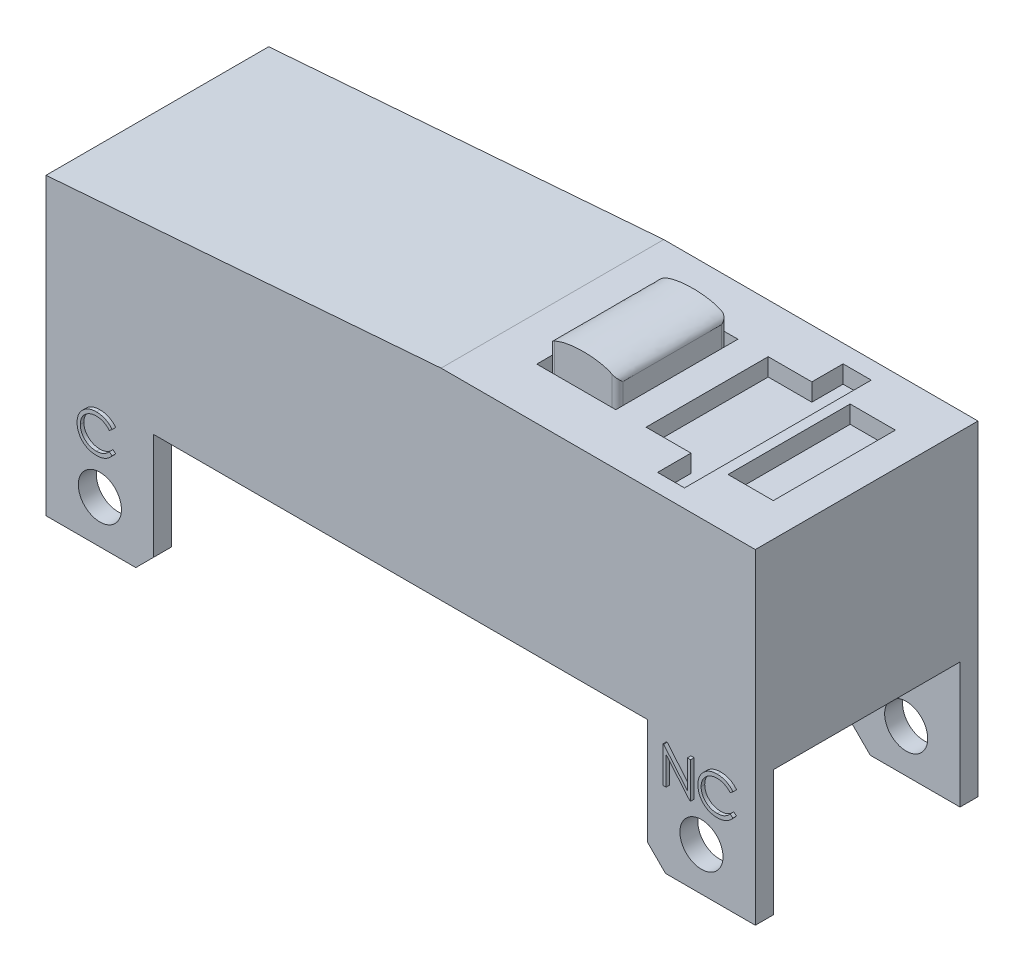
from build123d import *

# Parameters (mm, degrees)
SKETCH3_R               = 0.6
BOSS_EXTRUDE1_DEPTH     = 6.2
SHELL1_T                = -0.5
CUT_EXTRUDE1_DEPTH      = 22.672823682
CUT_EXTRUDE1_DEPTH_BACK = 22.672823682
SKETCH5_W               = 5.2
SKETCH5_H               = 3.5
SKETCH6_W               = 1.26
SKETCH6_H               = 3.4
CUT_EXTRUDE2_DEPTH      = 0.49
SKETCH7_W               = 2.2
SKETCH7_H               = 3.4
CUT_EXTRUDE3_DEPTH      = 0.49
BOSS_EXTRUDE2_DEPTH     = 1.24
CUT_EXTRUDE4_DEPTH      = 15.430314711
CUT_EXTRUDE4_DEPTH_BACK = 15.430314711
BOSS_EXTRUDE3_DEPTH     = 0.1


with BuildPart() as part:
    # Sketch3 → Boss-Extrude1 (new body)
    with BuildSketch(Plane.XY):
        Polygon((11.659703504, 6.419407008), (5.659703504, 6.419407008), (2.909703504, 6.419407008), (-8.090296496, 5.569407008), (-8.090296496, -2.640592992), (-5.590296496, -2.640592992), (-5.090296496, -2.140592992), (-5.090296496, 0.819407008), (8.659703504, 0.819407008), (8.659703504, -2.140592992), (9.159703504, -2.640592992), (11.659703504, -2.640592992), align=None)
        with Locations((-6.590296496, -1.440592992)):
            Circle(SKETCH3_R, mode=Mode.SUBTRACT)
        with Locations((10.159703504, -1.440592992)):
            Circle(SKETCH3_R, mode=Mode.SUBTRACT)
    extrude(amount=BOSS_EXTRUDE1_DEPTH)

    # Shell1
    shell1_openings = [part.faces().sort_by_distance(p)[0] for p in [
        (10.409703504, -2.640592992, 3.1),
        (8.659703504, -0.660592992, 3.1),
        (1.784703504, 0.819407008, 3.1),
        (-5.090296496, -0.660592992, 3.1),
        (-6.840296496, -2.640592992, 3.1),
    ]]
    offset(amount=SHELL1_T, openings=shell1_openings)

    # Sketch5 → Cut-Extrude1 (cut, two sides: drawn at the far end of the back side and taken through both)
    with BuildSketch(Plane(origin=(11.659703504, 0, 0), x_dir=(0, 0, -1), z_dir=(1, 0, 0)).offset(-CUT_EXTRUDE1_DEPTH_BACK)):
        with Locations((-3.1, -0.890592992)):
            Rectangle(SKETCH5_W, SKETCH5_H)
    extrude(amount=CUT_EXTRUDE1_DEPTH + CUT_EXTRUDE1_DEPTH_BACK, mode=Mode.SUBTRACT)

    # Sketch6 → Cut-Extrude2 (cut)
    with BuildSketch(Plane(origin=(0, 6.419407008, 0), x_dir=(1, 0, 0), z_dir=(0, 1, 0))):
        with Locations((10.099703504, -3.07)):
            Rectangle(SKETCH6_W, SKETCH6_H)
    extrude(amount=-CUT_EXTRUDE2_DEPTH, mode=Mode.SUBTRACT)

    # Sketch7 → Cut-Extrude3 (cut)
    with BuildSketch(Plane(origin=(0, 6.419407008, 0), x_dir=(1, 0, 0), z_dir=(0, 1, 0))):
        Polygon((9.18784127, -0.5), (9.18784127, -5.7), (8.43784127, -5.7), (8.43784127, -4.77), (7.18784127, -4.77), (7.18784127, -1.37), (8.403045117, -1.37), (8.403045117, -0.5), align=None)
        with Locations((5.244810149, -3.07)):
            Rectangle(SKETCH7_W, SKETCH7_H)
    extrude(amount=-CUT_EXTRUDE3_DEPTH, mode=Mode.SUBTRACT)

    # Sketch8 → Boss-Extrude2 (add)
    with BuildSketch(Plane(origin=(0, 5.929407008, 0), x_dir=(1, 0, 0), z_dir=(0, 1, 0))):
        with BuildLine():
            Line((4.444810149, -1.52), (6.044810149, -1.52))
            ThreePointArc((6.044810149, -1.52), (6.150876166, -1.563933983), (6.194810149, -1.67))
            Line((6.194810149, -1.67), (6.194810149, -4.42))
            ThreePointArc((6.194810149, -4.42), (6.150876166, -4.526066017), (6.044810149, -4.57))
            Line((6.044810149, -4.57), (4.444810149, -4.57))
            ThreePointArc((4.444810149, -4.57), (4.338744132, -4.526066017), (4.294810149, -4.42))
            Line((4.294810149, -4.42), (4.294810149, -1.67))
            ThreePointArc((4.294810149, -1.67), (4.338744132, -1.563933983), (4.444810149, -1.52))
        make_face()
    extrude(amount=BOSS_EXTRUDE2_DEPTH)

    # Sketch9 → Cut-Extrude4 (cut, two sides: drawn at the far end of the back side and taken through both)
    with BuildSketch(Plane.XY.offset(4.57).offset(-CUT_EXTRUDE4_DEPTH_BACK)):
        with BuildLine():
            Line((4.294810149, 7.169407008), (4.294810149, 6.847617942))
            add(Edge.make_bspline(
                [(4.444810149, 7.021163032), (4.294810149, 6.941828134), (4.294810149, 6.847617942)],
                knots=[5.703153856, 5.703153856, 5.703153856, 6.283185307, 6.283185307, 6.283185307], degree=2, weights=[0.863566286, 0.891846399, 1]))
            Line((4.444810149, 7.021163032), (4.444810149, 7.169407008))
            Line((4.444810149, 7.169407008), (4.294810149, 7.169407008))
        make_face()
        with BuildLine():
            Line((4.444810149, 7.169407008), (4.444810149, 7.021163032))
            add(Edge.make_bspline(
                [(5.244810149, 7.169407008), (4.725097851, 7.169407008), (4.444810149, 7.021163032)],
                knots=[4.71238898, 4.71238898, 4.71238898, 5.703153856, 5.703153856, 5.703153856], degree=2, weights=[1, 0.815260382, 0.863566286]))
            Line((5.244810172, 7.169407008), (4.444810149, 7.169407008))
        make_face()
        with BuildLine():
            Line((6.044810149, 7.169407008), (5.244810172, 7.169407008))
            add(Edge.make_bspline(
                [(6.044810149, 7.021163032), (5.764522447, 7.169407008), (5.244810149, 7.169407008)],
                knots=[3.721624105, 3.721624105, 3.721624105, 4.71238898, 4.71238898, 4.71238898], degree=2, weights=[0.863566286, 0.815260382, 1]))
            Line((6.044810149, 7.021163032), (6.044810149, 7.169407008))
        make_face()
        with BuildLine():
            Line((6.194810149, 7.169407008), (6.044810149, 7.169407008))
            Line((6.044810149, 7.169407008), (6.044810149, 7.021163032))
            add(Edge.make_bspline(
                [(6.194810149, 6.847617942), (6.194810149, 6.941828134), (6.044810149, 7.021163032)],
                knots=[3.141592654, 3.141592654, 3.141592654, 3.721624105, 3.721624105, 3.721624105], degree=2, weights=[1, 0.891846399, 0.863566286]))
            Line((6.194810149, 6.847617942), (6.194810149, 7.169407008))
        make_face()
    extrude(amount=CUT_EXTRUDE4_DEPTH + CUT_EXTRUDE4_DEPTH_BACK, mode=Mode.SUBTRACT)

    # Sketch11 → Boss-Extrude3 (add)
    with BuildSketch(Plane.XY.offset(6.2)):
        Polygon((9.18687242, -0.45139452), (9.18687242, 0.54860548), (9.205702548, 0.54860548), (9.8663596, -0.238453815), (9.8663596, 0.54860548), (9.956103189, 0.54860548), (9.956103189, -0.45139452), (9.935670497, -0.45139452), (9.27661601, 0.333861891), (9.27661601, -0.45139452), align=None)
        with BuildLine():
            Line((11.135590369, 0.365111891), (11.057064728, 0.305015737))
            add(Edge.make_bspline(
                [(11.057064728, 0.305015737), (11.051463045, 0.311691728), (11.040335203, 0.324953704), (11.022432574, 0.343576431), (11.003774962, 0.361023649), (10.984369499, 0.377378471), (10.963866893, 0.392068976), (10.942763808, 0.40586072), (10.920707223, 0.41822293), (10.890206728, 0.433212355), (10.850307343, 0.448854114), (10.800080246, 0.461969323), (10.747648503, 0.47031823), (10.711877761, 0.47122247), (10.693683317, 0.471682403)],
                knots=[0, 0, 0, 0, 0.757959112, 1.505699292, 2.245454638, 2.979532153, 3.711538275, 4.438200793, 5.171680507, 5.909471876, 7.393775596, 8.890124382, 10.418191784, 12, 12, 12, 12], degree=3))
            add(Edge.make_bspline(
                [(10.693683317, 0.471682403), (10.683659518, 0.471566986), (10.663704948, 0.471337221), (10.634091099, 0.468306042), (10.605030227, 0.464045697), (10.576541237, 0.457724176), (10.548660391, 0.449731999), (10.521205419, 0.440181881), (10.494573819, 0.428366212), (10.46839718, 0.415306709), (10.443317405, 0.400556011), (10.419587392, 0.384466482), (10.397293687, 0.367218168), (10.376418655, 0.348746424), (10.356940955, 0.329134435), (10.339001723, 0.308173195), (10.322663035, 0.285929716), (10.307601028, 0.262697314), (10.294111675, 0.238543659), (10.282817424, 0.213379354), (10.27281596, 0.187635324), (10.264901891, 0.161020707), (10.258637743, 0.133722774), (10.254315554, 0.105668263), (10.251318848, 0.076915783), (10.251090226, 0.057427408), (10.250974984, 0.047603878)],
                knots=[0, 0, 0, 0, 1.054917814, 2.100044995, 3.131103042, 4.146048494, 5.169673617, 6.183595914, 7.203665975, 8.234915748, 9.262203917, 10.264457458, 11.251630812, 12.227803204, 13.197192746, 14.159520551, 15.12972552, 16.100847026, 17.073214652, 18.039054194, 19.002613845, 19.979014051, 20.95965708, 21.949030935, 22.966165397, 24, 24, 24, 24], degree=3))
            add(Edge.make_bspline(
                [(10.250974984, 0.047603878), (10.251335504, 0.032823501), (10.252043337, 0.003804191), (10.258342861, -0.038701698), (10.267915744, -0.079421891), (10.282263051, -0.118101845), (10.299954209, -0.155218519), (10.322308669, -0.190143906), (10.348199108, -0.223405781), (10.3779918, -0.254218052), (10.410679176, -0.282364831), (10.445750008, -0.307150711), (10.483116947, -0.327812106), (10.522367413, -0.345005234), (10.563803445, -0.358221442), (10.607350532, -0.367525477), (10.652913959, -0.373594672), (10.684048073, -0.374175725), (10.699893253, -0.374471443)],
                knots=[0, 0, 0, 0, 1.029171465, 2.020641659, 2.987623507, 3.938342917, 4.889210282, 5.84687017, 6.821220943, 7.821438502, 8.827599549, 9.822697543, 10.807740252, 11.797342354, 12.80366471, 13.83203677, 14.896651826, 16, 16, 16, 16], degree=3))
            add(Edge.make_bspline(
                [(10.699893253, -0.374471443), (10.717351165, -0.373988934), (10.75171251, -0.373039242), (10.802103375, -0.364993742), (10.850342165, -0.351948623), (10.896431475, -0.333692074), (10.940241374, -0.309959134), (10.98184042, -0.281188312), (11.021263726, -0.247105931), (11.044969806, -0.22108218), (11.057064728, -0.207804776)],
                knots=[0, 0, 0, 0, 1.028121516, 2.023589091, 2.998037872, 3.967518031, 4.937445131, 5.927275754, 6.942489185, 8, 8, 8, 8], degree=3))
            Line((11.057064728, -0.207804776), (11.135590369, -0.267299968))
            add(Edge.make_bspline(
                [(11.135590369, -0.267299968), (11.129270909, -0.275453812), (11.116662259, -0.291722442), (11.096245682, -0.314657216), (11.074737883, -0.336229798), (11.051979109, -0.356266261), (11.028231168, -0.375167537), (11.003067651, -0.392396632), (10.976819356, -0.408194027), (10.949575219, -0.422658863), (10.921364187, -0.435492362), (10.892220062, -0.446479153), (10.862268469, -0.455943407), (10.831508038, -0.463729674), (10.799874965, -0.469807127), (10.767483401, -0.473869891), (10.734263437, -0.476653295), (10.711851602, -0.476906986), (10.700494215, -0.477035545)],
                knots=[0, 0, 0, 0, 0.986787822, 1.968848986, 2.935600012, 3.899624008, 4.868462664, 5.837806735, 6.815139263, 7.798259679, 8.787526145, 9.778297419, 10.776456485, 11.791383307, 12.812564526, 13.85620153, 14.913611965, 16, 16, 16, 16], degree=3))
            add(Edge.make_bspline(
                [(10.700494215, -0.477035545), (10.689738881, -0.47696069), (10.668471541, -0.476812674), (10.637071898, -0.474414912), (10.606503446, -0.471143558), (10.576853553, -0.466217806), (10.547960418, -0.460405138), (10.520085965, -0.45261335), (10.492955905, -0.443885017), (10.466679236, -0.433626449), (10.441233608, -0.422050397), (10.41670109, -0.408967095), (10.393092966, -0.394486562), (10.370177132, -0.378927987), (10.348292108, -0.361791616), (10.327248244, -0.343315434), (10.306927536, -0.323561717), (10.29435534, -0.309317473), (10.288034279, -0.302155738)],
                knots=[0, 0, 0, 0, 1.114604814, 2.203992996, 3.262667896, 4.300477797, 5.318619304, 6.316056647, 7.298880507, 8.271930387, 9.238335007, 10.195173496, 11.151986948, 12.108099108, 13.064862484, 14.031167946, 15.010108607, 16, 16, 16, 16], degree=3))
            add(Edge.make_bspline(
                [(10.288034279, -0.302155738), (10.277909809, -0.289715398), (10.257783102, -0.264984909), (10.232032906, -0.2249032), (10.209990748, -0.183055141), (10.192169056, -0.139220875), (10.178236847, -0.093498765), (10.168585077, -0.04586576), (10.16231319, 0.003633652), (10.161595964, 0.037301305), (10.161231394, 0.054414775)],
                knots=[0, 0, 0, 0, 0.994628077, 1.977248131, 2.950237994, 3.925870899, 4.908910175, 5.911660606, 6.938484602, 8, 8, 8, 8], degree=3))
            add(Edge.make_bspline(
                [(10.161231394, 0.054414775), (10.161675735, 0.072402048), (10.162549949, 0.107790883), (10.169977319, 0.159726298), (10.181925546, 0.209483841), (10.198896086, 0.256970625), (10.220411901, 0.30243642), (10.246990933, 0.345533907), (10.278324402, 0.386538707), (10.314166564, 0.424828635), (10.353471517, 0.459839879), (10.395562607, 0.490641652), (10.440357449, 0.516275228), (10.48736255, 0.537702703), (10.536929887, 0.554172549), (10.588953707, 0.565702031), (10.643336254, 0.57287835), (10.680439804, 0.573785552), (10.699292292, 0.574246506)],
                knots=[0, 0, 0, 0, 1.032925535, 2.032216505, 3.007276963, 3.968222605, 4.92396291, 5.891752235, 6.871517503, 7.883894988, 8.900124299, 9.891468569, 10.874487609, 11.85992873, 12.854644235, 13.869047385, 14.917252991, 16, 16, 16, 16], degree=3))
            add(Edge.make_bspline(
                [(10.699292292, 0.574246506), (10.710782141, 0.574108752), (10.73352514, 0.573836083), (10.767168755, 0.571177185), (10.799923706, 0.566744726), (10.831812558, 0.560711563), (10.862990448, 0.553223757), (10.893219088, 0.543469386), (10.922675856, 0.532316091), (10.951174973, 0.519470815), (10.978579701, 0.505051746), (11.004881507, 0.489218711), (11.029871466, 0.471991338), (11.053725423, 0.453516145), (11.07604434, 0.433402271), (11.097461906, 0.412202958), (11.117250785, 0.38930758), (11.129465984, 0.373191884), (11.135590369, 0.365111891)],
                knots=[0, 0, 0, 0, 1.096760587, 2.17092713, 3.219439832, 4.250915756, 5.268269357, 6.278326846, 7.281116186, 8.274029601, 9.260640565, 10.235837813, 11.203064059, 12.156899882, 13.114053108, 14.069676657, 15.032185724, 16, 16, 16, 16], degree=3))
        make_face()
        with BuildLine():
            Line((-6.15051233, 0.457442588), (-6.229037971, 0.397346434))
            add(Edge.make_bspline(
                [(-6.229037971, 0.397346434), (-6.234639654, 0.404022425), (-6.245767496, 0.417284401), (-6.263670125, 0.435907128), (-6.282327737, 0.453354346), (-6.3017332, 0.469709169), (-6.322235806, 0.484399673), (-6.343338891, 0.498191417), (-6.365395476, 0.510553628), (-6.395895971, 0.525543052), (-6.435795356, 0.541184811), (-6.486022453, 0.55430002), (-6.538454196, 0.562648927), (-6.574224938, 0.563553167), (-6.592419382, 0.564013101)],
                knots=[0, 0, 0, 0, 0.757959112, 1.505699292, 2.245454638, 2.979532153, 3.711538275, 4.438200793, 5.171680507, 5.909471876, 7.393775596, 8.890124382, 10.418191784, 12, 12, 12, 12], degree=3))
            add(Edge.make_bspline(
                [(-6.592419382, 0.564013101), (-6.602443181, 0.563897683), (-6.622397751, 0.563667918), (-6.6520116, 0.56063674), (-6.681072472, 0.556376394), (-6.709561462, 0.550054873), (-6.737442308, 0.542062696), (-6.76489728, 0.532512578), (-6.79152888, 0.520696909), (-6.817705519, 0.507637406), (-6.842785294, 0.492886708), (-6.866515307, 0.476797179), (-6.888809012, 0.459548866), (-6.909684044, 0.441077121), (-6.929161744, 0.421465132), (-6.947100976, 0.400503892), (-6.963439664, 0.378260414), (-6.978501671, 0.355028011), (-6.991991024, 0.330874357), (-7.003285275, 0.305710051), (-7.013286739, 0.279966021), (-7.021200808, 0.253351404), (-7.027464956, 0.226053471), (-7.031787145, 0.19799896), (-7.034783851, 0.16924648), (-7.035012473, 0.149758105), (-7.035127715, 0.139934575)],
                knots=[0, 0, 0, 0, 1.054917814, 2.100044995, 3.131103042, 4.146048494, 5.169673617, 6.183595914, 7.203665975, 8.234915748, 9.262203917, 10.264457458, 11.251630812, 12.227803204, 13.197192746, 14.159520551, 15.12972552, 16.100847026, 17.073214652, 18.039054194, 19.002613845, 19.979014051, 20.95965708, 21.949030935, 22.966165397, 24, 24, 24, 24], degree=3))
            add(Edge.make_bspline(
                [(-7.035127715, 0.139934575), (-7.034767195, 0.125154198), (-7.034059362, 0.096134888), (-7.027759838, 0.053628999), (-7.018186955, 0.012908807), (-7.003839648, -0.025771148), (-6.98614849, -0.062887822), (-6.96379403, -0.097813209), (-6.937903591, -0.131075084), (-6.908110899, -0.161887355), (-6.875423523, -0.190034134), (-6.840352691, -0.214820014), (-6.802985752, -0.235481409), (-6.763735286, -0.252674537), (-6.722299254, -0.265890745), (-6.678752167, -0.27519478), (-6.63318874, -0.281263974), (-6.602054626, -0.281845028), (-6.586209446, -0.282140746)],
                knots=[0, 0, 0, 0, 1.029171465, 2.020641659, 2.987623507, 3.938342917, 4.889210282, 5.84687017, 6.821220943, 7.821438502, 8.827599549, 9.822697543, 10.807740252, 11.797342354, 12.80366471, 13.83203677, 14.896651826, 16, 16, 16, 16], degree=3))
            add(Edge.make_bspline(
                [(-6.586209446, -0.282140746), (-6.568751534, -0.281658237), (-6.534390189, -0.280708545), (-6.483999324, -0.272663045), (-6.435760534, -0.259617926), (-6.389671224, -0.241361376), (-6.345861325, -0.217628437), (-6.304262279, -0.188857615), (-6.264838973, -0.154775234), (-6.241132893, -0.128751483), (-6.229037971, -0.115474079)],
                knots=[0, 0, 0, 0, 1.028121516, 2.023589091, 2.998037872, 3.967518031, 4.937445131, 5.927275754, 6.942489185, 8, 8, 8, 8], degree=3))
            Line((-6.229037971, -0.115474079), (-6.15051233, -0.174969271))
            add(Edge.make_bspline(
                [(-6.15051233, -0.174969271), (-6.15683179, -0.183123115), (-6.16944044, -0.199391745), (-6.189857017, -0.222326519), (-6.211364816, -0.243899101), (-6.23412359, -0.263935564), (-6.257871531, -0.28283684), (-6.283035048, -0.300065934), (-6.309283343, -0.31586333), (-6.33652748, -0.330328166), (-6.364738512, -0.343161665), (-6.393882637, -0.354148455), (-6.42383423, -0.36361271), (-6.454594661, -0.371398977), (-6.486227734, -0.37747643), (-6.518619298, -0.381539194), (-6.551839262, -0.384322598), (-6.574251097, -0.384576288), (-6.585608484, -0.384704848)],
                knots=[0, 0, 0, 0, 0.986787822, 1.968848986, 2.935600012, 3.899624008, 4.868462664, 5.837806735, 6.815139263, 7.798259679, 8.787526145, 9.778297419, 10.776456485, 11.791383307, 12.812564526, 13.85620153, 14.913611965, 16, 16, 16, 16], degree=3))
            add(Edge.make_bspline(
                [(-6.585608484, -0.384704848), (-6.596363818, -0.384629993), (-6.617631158, -0.384481977), (-6.649030801, -0.382084214), (-6.679599253, -0.378812861), (-6.709249146, -0.373887109), (-6.738142281, -0.368074441), (-6.766016734, -0.360282653), (-6.793146794, -0.35155432), (-6.819423463, -0.341295752), (-6.844869091, -0.3297197), (-6.869401609, -0.316636397), (-6.893009733, -0.302155865), (-6.915925567, -0.28659729), (-6.937810591, -0.269460918), (-6.958854455, -0.250984737), (-6.979175163, -0.23123102), (-6.991747359, -0.216986776), (-6.99806842, -0.20982504)],
                knots=[0, 0, 0, 0, 1.114604814, 2.203992996, 3.262667896, 4.300477797, 5.318619304, 6.316056647, 7.298880507, 8.271930387, 9.238335007, 10.195173496, 11.151986948, 12.108099108, 13.064862484, 14.031167946, 15.010108607, 16, 16, 16, 16], degree=3))
            add(Edge.make_bspline(
                [(-6.99806842, -0.20982504), (-7.00819289, -0.197384701), (-7.028319597, -0.172654212), (-7.054069793, -0.132572503), (-7.076111951, -0.090724443), (-7.093933643, -0.046890178), (-7.107865852, -0.001168067), (-7.117517622, 0.046464937), (-7.123789509, 0.095964349), (-7.124506735, 0.129632003), (-7.124871305, 0.146745472)],
                knots=[0, 0, 0, 0, 0.994628077, 1.977248131, 2.950237994, 3.925870899, 4.908910175, 5.911660606, 6.938484602, 8, 8, 8, 8], degree=3))
            add(Edge.make_bspline(
                [(-7.124871305, 0.146745472), (-7.124426964, 0.164732745), (-7.12355275, 0.20012158), (-7.11612538, 0.252056996), (-7.104177153, 0.301814538), (-7.087206613, 0.349301322), (-7.065690798, 0.394767117), (-7.039111766, 0.437864604), (-7.007778297, 0.478869404), (-6.971936135, 0.517159333), (-6.932631182, 0.552170576), (-6.890540092, 0.582972349), (-6.84574525, 0.608605925), (-6.798740149, 0.6300334), (-6.749172812, 0.646503246), (-6.697148992, 0.658032728), (-6.642766445, 0.665209047), (-6.605662895, 0.666116249), (-6.586810407, 0.666577203)],
                knots=[0, 0, 0, 0, 1.032925535, 2.032216505, 3.007276963, 3.968222605, 4.92396291, 5.891752235, 6.871517503, 7.883894988, 8.900124299, 9.891468569, 10.874487609, 11.85992873, 12.854644235, 13.869047385, 14.917252991, 16, 16, 16, 16], degree=3))
            add(Edge.make_bspline(
                [(-6.586810407, 0.666577203), (-6.575320558, 0.666439449), (-6.552577559, 0.66616678), (-6.518933944, 0.663507882), (-6.486178993, 0.659075423), (-6.454290141, 0.65304226), (-6.423112251, 0.645554454), (-6.392883611, 0.635800083), (-6.363426843, 0.624646789), (-6.334927726, 0.611801513), (-6.307522998, 0.597382444), (-6.281221192, 0.581549408), (-6.256231233, 0.564322035), (-6.232377276, 0.545846842), (-6.210058359, 0.525732968), (-6.188640793, 0.504533655), (-6.168851914, 0.481638277), (-6.156636715, 0.465522581), (-6.15051233, 0.457442588)],
                knots=[0, 0, 0, 0, 1.096760587, 2.17092713, 3.219439832, 4.250915756, 5.268269357, 6.278326846, 7.281116186, 8.274029601, 9.260640565, 10.235837813, 11.203064059, 12.156899882, 13.114053108, 14.069676657, 15.032185724, 16, 16, 16, 16], degree=3))
        make_face()
    extrude(amount=BOSS_EXTRUDE3_DEPTH)


solid = part.part
